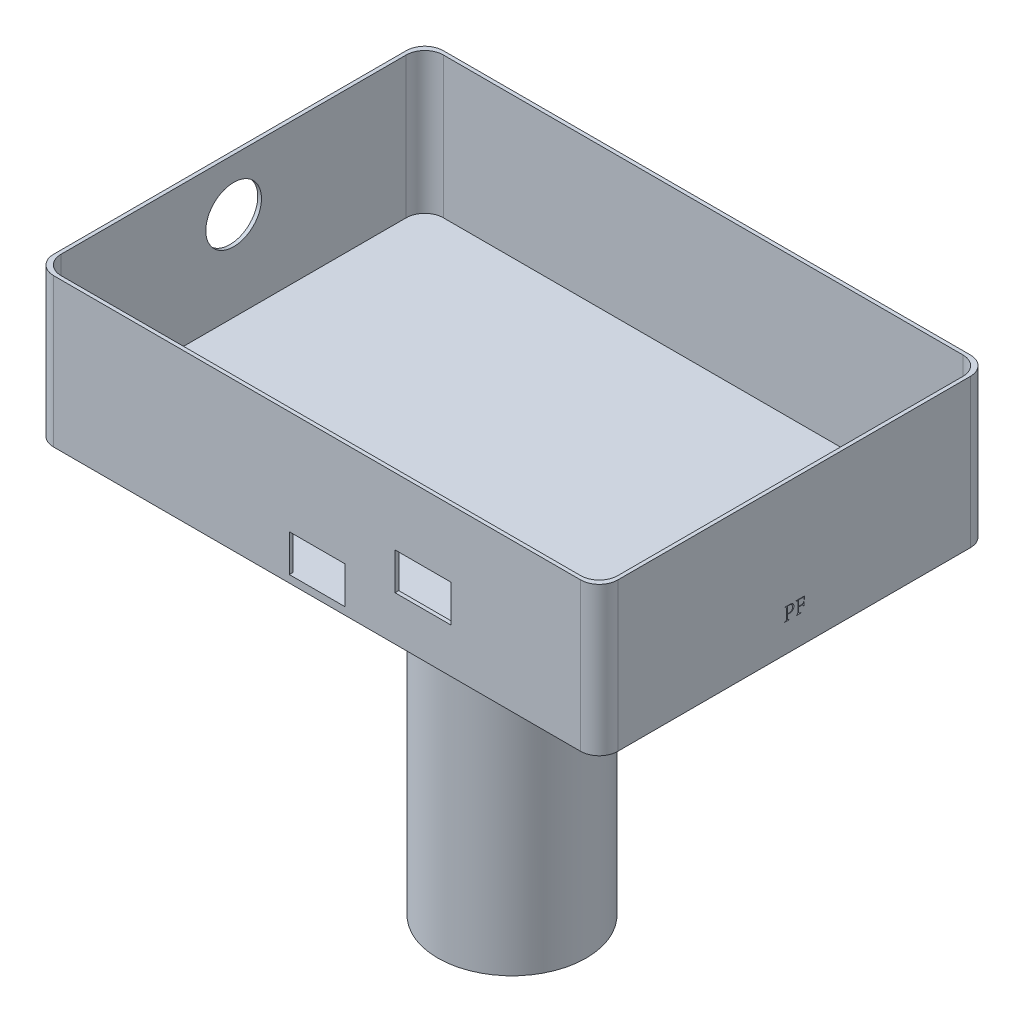
from build123d import *

# Parameters (mm, degrees)
EXTRUDE_4_DEPTH     = 40
SKETCH_4_R          = 20
EXTRUDE_5_DEPTH     = 100
CUT_EXTRUDE_1_DEPTH = 38
SKETCH_9_W          = 15
SKETCH_9_H          = 10
CUT_EXTRUDE_2_DEPTH = 38
SKETCH_13_R         = 7.5
CUT_EXTRUDE_4_DEPTH = 38
SKETCH_14_W         = 15
SKETCH_14_H         = 10
CUT_EXTRUDE_6_DEPTH = 33
CUT_EXTRUDE_7_DEPTH = 0.5


with BuildPart() as part:
    # 草图1 → 凸台-拉伸4 (new body)
    with BuildSketch(Plane(origin=(0, 0, 0), x_dir=(1, 0, 0), z_dir=(0, 1, 0))):
        with BuildLine():
            Line((71, -52.5), (-71, -52.5))
            ThreePointArc((-71, -52.5), (-74.535533906, -51.035533906), (-76, -47.5))
            Line((-76, -47.5), (-76, 47.5))
            ThreePointArc((-76, 47.5), (-74.535533906, 51.035533906), (-71, 52.5))
            Line((-71, 52.5), (71, 52.5))
            ThreePointArc((71, 52.5), (74.535533906, 51.035533906), (76, 47.5))
            Line((76, 47.5), (76, -47.5))
            ThreePointArc((76, -47.5), (74.535533906, -51.035533906), (71, -52.5))
        make_face()
    extrude(amount=EXTRUDE_4_DEPTH)

    # 草图4 → 凸台-拉伸5 (add)
    with BuildSketch(Plane.XZ):
        with Locations(Location((0, 0, 0), (0, 0, 90))):
            Circle(SKETCH_4_R)
    extrude(amount=EXTRUDE_5_DEPTH)

    # 草图5 → 切除-拉伸1 (cut)
    with BuildSketch(Plane(origin=(0, 40, 0), x_dir=(1, 0, 0), z_dir=(0, 1, 0))):
        with BuildLine():
            Line((70, -51.5), (-70, -51.5))
            ThreePointArc((-70, -51.5), (-73.535533906, -50.035533906), (-75, -46.5))
            Line((-75, -46.5), (-75, 46.5))
            ThreePointArc((-75, 46.5), (-73.535533906, 50.035533906), (-70, 51.5))
            Line((-70, 51.5), (70, 51.5))
            ThreePointArc((70, 51.5), (73.535533906, 50.035533906), (75, 46.5))
            Line((75, 46.5), (75, -46.5))
            ThreePointArc((75, -46.5), (73.535533906, -50.035533906), (70, -51.5))
        make_face()
    extrude(amount=-CUT_EXTRUDE_1_DEPTH, mode=Mode.SUBTRACT)

    # 草图9 → 切除-拉伸2 (cut)
    with BuildSketch(Plane.XY.offset(52.5)):
        with Locations((0, 7)):
            Rectangle(SKETCH_9_W, SKETCH_9_H)
    extrude(amount=-CUT_EXTRUDE_2_DEPTH, mode=Mode.SUBTRACT)

    # 草图13 → 切除-拉伸4 (cut)
    with BuildSketch(Plane.ZY.offset(76)):
        with Locations((0, 26)):
            Circle(SKETCH_13_R)
    extrude(amount=-CUT_EXTRUDE_4_DEPTH, mode=Mode.SUBTRACT)

    # 草图14 → 切除-拉伸6 (cut)
    with BuildSketch(Plane.XY.offset(52.5)):
        with Locations((28.5, 17)):
            Rectangle(SKETCH_14_W, SKETCH_14_H)
    extrude(amount=-CUT_EXTRUDE_6_DEPTH, mode=Mode.SUBTRACT)

    # 草图15 → 切除-拉伸7 (cut)
    # profile 1 of 2: a face of its own
    with BuildSketch(Plane(origin=(76, 0, 0), x_dir=(0, 0, -1), z_dir=(1, 0, 0))):
        with BuildLine():
            Line((-2.580433871, 7.615726026), (-1.184449748, 7.615726026))
            Line((-1.184449748, 7.615726026), (-1.184449748, 7.702983664))
            add(Edge.make_bspline(
                [(-1.184449748, 7.702983664), (-1.217887836, 7.704611127), (-1.281310199, 7.707697954), (-1.371570183, 7.716076705), (-1.452188861, 7.725517964), (-1.522984698, 7.740587685), (-1.584238129, 7.756859859), (-1.636092582, 7.776290379), (-1.678677618, 7.798158136), (-1.712060535, 7.825330905), (-1.737693269, 7.857367058), (-1.758960256, 7.894767642), (-1.776807786, 7.938377806), (-1.788989433, 7.989121396), (-1.798954138, 8.045760276), (-1.803947593, 8.10928206), (-1.806924831, 8.179133503), (-1.804608248, 8.227877841), (-1.80340521, 8.253191544)],
                knots=[0, 0, 0, 0, 1.610224412, 3.054129168, 4.360599012, 5.511614898, 6.533143897, 7.406572097, 8.171725483, 8.825313618, 9.460670599, 10.133992217, 10.889431778, 11.719000167, 12.639127231, 13.653731648, 14.781545869, 16, 16, 16, 16], degree=3))
            Line((-1.80340521, 8.253191544), (-1.80340521, 9.168971463))
            Line((-1.80340521, 9.168971463), (-1.349125342, 9.063555665))
            add(Edge.make_bspline(
                [(-1.349125342, 9.063555665), (-1.313407427, 9.060448233), (-1.241972221, 9.054233423), (-1.134088744, 9.057226738), (-1.026491828, 9.069244977), (-0.919397483, 9.09115194), (-0.8131608, 9.123224615), (-0.706868332, 9.163612709), (-0.601038304, 9.213985577), (-0.496619222, 9.27302888), (-0.397094747, 9.341624436), (-0.310282121, 9.424762169), (-0.233624583, 9.51722492), (-0.172009666, 9.622897296), (-0.120233509, 9.738274164), (-0.082947926, 9.865548019), (-0.056679339, 10.003585749), (-0.049725119, 10.099757617), (-0.046133345, 10.149429275)],
                knots=[0, 0, 0, 0, 0.895391462, 1.790767267, 2.691590428, 3.598402855, 4.518333195, 5.4620595, 6.437508577, 7.444288359, 8.458286257, 9.44859864, 10.438796661, 11.449931416, 12.495491309, 13.592056924, 14.756325249, 16, 16, 16, 16], degree=3))
            add(Edge.make_bspline(
                [(-0.046133345, 10.149429275), (-0.050867358, 10.202863163), (-0.059937832, 10.305243687), (-0.087522531, 10.450444572), (-0.128774532, 10.579646587), (-0.182093158, 10.693268606), (-0.24744051, 10.79169477), (-0.326685217, 10.873361857), (-0.418041904, 10.939022364), (-0.520539476, 10.985615104), (-0.625214666, 11.022099111), (-0.727706194, 11.053736118), (-0.826357096, 11.079625145), (-0.921130609, 11.10035463), (-1.012403319, 11.113936181), (-1.099777459, 11.122060151), (-1.183501439, 11.125266693), (-1.237857238, 11.121576074), (-1.264508505, 11.119766521)],
                knots=[0, 0, 0, 0, 1.445463838, 2.769541052, 3.974832343, 5.091891974, 6.142931429, 7.144046555, 8.143238359, 9.156363058, 10.166726981, 11.131189545, 12.046821227, 12.915368631, 13.744935411, 14.532326559, 15.280383024, 16, 16, 16, 16], degree=3))
            Line((-1.264508505, 11.119766521), (-2.546926408, 11.120573673))
            Line((-2.546926408, 11.120573673), (-2.546926408, 11.047858186))
            add(Edge.make_bspline(
                [(-2.546926408, 11.047858186), (-2.519113283, 11.046605321), (-2.466210685, 11.044222281), (-2.390778606, 11.039380374), (-2.323844346, 11.029666864), (-2.265398562, 11.017070124), (-2.215635131, 11.001255054), (-2.174493065, 10.981815226), (-2.14132869, 10.959515086), (-2.116186354, 10.932010665), (-2.098648993, 10.898804169), (-2.083154106, 10.860727055), (-2.071203393, 10.815659302), (-2.062790431, 10.763681545), (-2.056263177, 10.704905612), (-2.053248632, 10.639076125), (-2.05349167, 10.566573064), (-2.055331496, 10.515961179), (-2.05629077, 10.489572473)],
                knots=[0, 0, 0, 0, 1.469172523, 2.794473568, 3.98619609, 5.034299873, 5.946533644, 6.734663907, 7.428501719, 8.042184951, 8.678485103, 9.398881281, 10.208995993, 11.131793981, 12.175360288, 13.327801444, 14.606733132, 16, 16, 16, 16], degree=3))
            Line((-2.05629077, 10.489572473), (-2.055483618, 8.265228604))
            add(Edge.make_bspline(
                [(-2.055483618, 8.265228604), (-2.055086813, 8.239137028), (-2.054329569, 8.18934508), (-2.055237138, 8.117860075), (-2.061440663, 8.05322217), (-2.068677643, 7.994697701), (-2.081000159, 7.942863416), (-2.095806553, 7.897366932), (-2.114855608, 7.858714559), (-2.136513671, 7.824960353), (-2.165954266, 7.797296608), (-2.201708529, 7.772862243), (-2.246216778, 7.753073059), (-2.297997972, 7.736368002), (-2.357488345, 7.722805269), (-2.42467847, 7.712268763), (-2.5000366, 7.706394752), (-2.552898268, 7.704157803), (-2.580644535, 7.702983664)],
                knots=[0, 0, 0, 0, 1.352566959, 2.581175796, 3.702071017, 4.716683575, 5.634193904, 6.459598048, 7.189955645, 7.863557963, 8.524901329, 9.268214695, 10.098795313, 11.038958449, 12.085146358, 13.257772726, 14.560647532, 16, 16, 16, 16], degree=3))
            Line((-2.580644535, 7.702983664), (-2.580433871, 7.615726026))
        make_face()
        with BuildLine():
            add(Edge.make_bspline(
                [(-1.80340521, 10.870368363), (-1.803275178, 10.883485644), (-1.803038031, 10.907408495), (-1.800853886, 10.939442273), (-1.797114279, 10.964223374), (-1.790438189, 10.98650258), (-1.774527452, 11.007344278), (-1.756000381, 11.010127635), (-1.746849334, 11.011502415)],
                knots=[0, 0, 0, 0, 1.400212761, 2.553660238, 3.428222368, 4.06475085, 5.044125359, 6, 6, 6, 6], degree=3))
            add(Edge.make_bspline(
                [(-1.746849334, 11.011502415), (-1.732333412, 11.013896229), (-1.697033855, 11.019717464), (-1.634027929, 11.022492428), (-1.552150696, 11.02418129), (-1.491274448, 11.02330064), (-1.457606424, 11.02281359)],
                knots=[0, 0, 0, 0, 0.60862256, 1.480037451, 2.606317572, 4, 4, 4, 4], degree=3))
            add(Edge.make_bspline(
                [(-1.457606424, 11.02281359), (-1.415028593, 11.02294623), (-1.332708624, 11.023202674), (-1.21324392, 11.012612629), (-1.101724199, 10.997619245), (-0.998676435, 10.972843602), (-0.903560234, 10.942506908), (-0.816245841, 10.904707718), (-0.737813817, 10.858182896), (-0.66659504, 10.805901042), (-0.604804481, 10.74498294), (-0.549814555, 10.677868387), (-0.504883746, 10.602024457), (-0.467676446, 10.519549093), (-0.437091671, 10.430515764), (-0.418012963, 10.33345159), (-0.404436289, 10.229793047), (-0.4025826, 10.158095807), (-0.401627424, 10.121151337)],
                knots=[0, 0, 0, 0, 1.281728033, 2.478092719, 3.609181804, 4.667700609, 5.665553503, 6.613529977, 7.526142766, 8.407058906, 9.267495489, 10.132736248, 11.01331621, 11.913552417, 12.854946971, 13.841293126, 14.887652011, 16, 16, 16, 16], degree=3))
            add(Edge.make_bspline(
                [(-0.401627424, 10.121151337), (-0.403263666, 10.081802189), (-0.406433639, 10.005569119), (-0.419511634, 9.895343473), (-0.442762129, 9.794270143), (-0.471012268, 9.700832781), (-0.509575532, 9.616604898), (-0.554553588, 9.53987683), (-0.608257919, 9.471973879), (-0.670479969, 9.414003602), (-0.737523718, 9.363074736), (-0.809183381, 9.319383045), (-0.884427059, 9.281834134), (-0.964182583, 9.252156893), (-1.047593284, 9.228447812), (-1.135243127, 9.212448638), (-1.226881723, 9.203537277), (-1.289265713, 9.202864998), (-1.321064381, 9.202522321)],
                knots=[0, 0, 0, 0, 1.278718646, 2.477325474, 3.597568387, 4.643053014, 5.641120743, 6.597994187, 7.525359563, 8.440897669, 9.352165556, 10.255086548, 11.162443487, 12.078524405, 13.01430469, 13.974847691, 14.967729619, 16, 16, 16, 16], degree=3))
            add(Edge.make_bspline(
                [(-1.321064381, 9.202522321), (-1.352578093, 9.203434737), (-1.412419569, 9.205167326), (-1.497174897, 9.210150382), (-1.571897215, 9.219883304), (-1.636388903, 9.232475544), (-1.690991351, 9.247766011), (-1.736659199, 9.261024443), (-1.77350676, 9.273639987), (-1.794304217, 9.283180983), (-1.80340521, 9.287356135)],
                knots=[0, 0, 0, 0, 1.534207126, 2.913310228, 4.129203918, 5.198384672, 6.107569974, 6.887083024, 7.512986147, 8, 8, 8, 8], degree=3))
            Line((-1.80340521, 9.287356135), (-1.80340521, 10.870368363))
        make_face(mode=Mode.SUBTRACT)
    # profile 2 of 2: a face of its own
    with BuildSketch(Plane(origin=(76, 0, 0), x_dir=(0, 0, -1), z_dir=(1, 0, 0))):
        with BuildLine():
            Line((0.481520828, 7.615726026), (1.858590923, 7.615726026))
            Line((1.858590923, 7.615726026), (1.858590923, 7.702983664))
            add(Edge.make_bspline(
                [(1.858590923, 7.702983664), (1.826127243, 7.704399003), (1.764235555, 7.707097335), (1.676171643, 7.714060831), (1.597655207, 7.724364586), (1.528448838, 7.737809985), (1.468583714, 7.75486599), (1.417150913, 7.77347354), (1.375453186, 7.796364383), (1.341145047, 7.821675688), (1.315676216, 7.853569353), (1.293369387, 7.889399026), (1.275988646, 7.931811364), (1.262349955, 7.979783361), (1.252717181, 8.033647793), (1.247620787, 8.093382205), (1.244863565, 8.159192631), (1.246515616, 8.204984741), (1.247380335, 8.228953311)],
                knots=[0, 0, 0, 0, 1.612812098, 3.074810424, 4.383035268, 5.541760787, 6.570003785, 7.471184564, 8.248906435, 8.925378342, 9.5706208, 10.260691492, 11.015443248, 11.836202244, 12.732910634, 13.726509569, 14.810006438, 16, 16, 16, 16], degree=3))
            Line((1.247380335, 8.228953311), (1.247380335, 9.322096813))
            Line((1.247380335, 9.322096813), (1.886371788, 9.322096813))
            add(Edge.make_bspline(
                [(1.886371788, 9.322096813), (1.916023097, 9.322224585), (1.972884168, 9.322469607), (2.054394924, 9.320805354), (2.128168324, 9.313701547), (2.194005078, 9.305973761), (2.251483236, 9.29264307), (2.300935893, 9.276944342), (2.342713557, 9.257734164), (2.37774091, 9.234320302), (2.406659175, 9.204727756), (2.432446454, 9.16935428), (2.45698685, 9.127879601), (2.478413044, 9.078842822), (2.498415218, 9.023175994), (2.516927992, 8.960579597), (2.533989114, 8.891349285), (2.542787092, 8.842507294), (2.547357544, 8.817134423)],
                knots=[0, 0, 0, 0, 1.476390129, 2.831211388, 4.056059684, 5.165377168, 6.128153901, 6.988890835, 7.74464011, 8.410338634, 9.074008615, 9.792690908, 10.586041567, 11.468233181, 12.452249512, 13.529751679, 14.716733466, 16, 16, 16, 16], degree=3))
            Line((2.547357544, 8.817134423), (2.642494185, 8.817925795))
            Line((2.642494185, 8.817925795), (2.642494185, 9.886150942))
            Line((2.642494185, 9.886150942), (2.547556373, 9.886150942))
            add(Edge.make_bspline(
                [(2.547556373, 9.886150942), (2.542933924, 9.864227706), (2.534089362, 9.822279939), (2.516752497, 9.763045443), (2.498577215, 9.709732742), (2.478215101, 9.662522671), (2.456640757, 9.620799945), (2.432486716, 9.585292873), (2.406625303, 9.555384723), (2.376963978, 9.531757837), (2.342243746, 9.512664205), (2.300716286, 9.496596657), (2.251231757, 9.484295322), (2.193776426, 9.473676414), (2.128210666, 9.465867693), (2.054317131, 9.461151344), (1.972642773, 9.459812544), (1.915546386, 9.460633605), (1.885653794, 9.461063469)],
                knots=[0, 0, 0, 0, 1.190162907, 2.27724938, 3.27749917, 4.181373813, 5.007218353, 5.769348776, 6.458667662, 7.100122601, 7.772901438, 8.556889018, 9.459403086, 10.478316619, 11.660529519, 12.965676839, 14.411391847, 16, 16, 16, 16], degree=3))
            Line((1.885653794, 9.461063469), (1.247380335, 9.461063469))
            Line((1.247380335, 9.461063469), (1.247380335, 10.82022473))
            add(Edge.make_bspline(
                [(1.247380335, 10.82022473), (1.246989393, 10.836065718), (1.246283917, 10.864651642), (1.250459095, 10.902725528), (1.256339972, 10.93223892), (1.269555706, 10.953777085), (1.291094302, 10.966996047), (1.320345024, 10.972806124), (1.358204927, 10.977098582), (1.38659408, 10.976364455), (1.402505024, 10.975953007)],
                knots=[0, 0, 0, 0, 1.388497183, 2.505618589, 3.35976118, 4.00876083, 4.657760479, 5.51190307, 6.60552478, 8, 8, 8, 8], degree=3))
            Line((1.402505024, 10.975953007), (1.869703269, 10.97675937))
            add(Edge.make_bspline(
                [(1.869703269, 10.97675937), (1.906805024, 10.976852428), (1.978435023, 10.97703209), (2.081410267, 10.971468457), (2.175570019, 10.961092785), (2.260860881, 10.946343292), (2.337242579, 10.925027748), (2.405490742, 10.900007573), (2.464319194, 10.868157763), (2.515438936, 10.830878731), (2.559599617, 10.786079009), (2.599878646, 10.733646409), (2.634724024, 10.671707096), (2.667211651, 10.60177484), (2.69612125, 10.523423687), (2.720956394, 10.436106035), (2.742849161, 10.340402072), (2.753517513, 10.273119685), (2.759038109, 10.238302795)],
                knots=[0, 0, 0, 0, 1.342337298, 2.591565296, 3.729065641, 4.768911272, 5.719339229, 6.595308682, 7.393271532, 8.131968119, 8.876172187, 9.661660477, 10.517449658, 11.441739127, 12.450008598, 13.535606943, 14.724740488, 16, 16, 16, 16], degree=3))
            Line((2.759038109, 10.238302795), (2.860292694, 10.249712596))
            add(Edge.make_bspline(
                [(2.860292694, 10.249712596), (2.853661303, 10.318056227), (2.840147105, 10.457334607), (2.826193495, 10.670165179), (2.815392107, 10.890223929), (2.811775477, 11.039230472), (2.809938397, 11.114918874)],
                knots=[0, 0, 0, 0, 0.950422415, 1.936878263, 2.952029999, 4, 4, 4, 4], degree=3))
            Line((2.809938397, 11.114918874), (0.481520828, 11.115726026))
            Line((0.481520828, 11.115726026), (0.481520828, 11.034664445))
            add(Edge.make_bspline(
                [(0.481520828, 11.034664445), (0.508448985, 11.033392648), (0.559982699, 11.030958748), (0.633241102, 11.023489849), (0.699334136, 11.014605961), (0.757194729, 11.000482558), (0.808105381, 10.985229257), (0.850351381, 10.964536377), (0.886025271, 10.942203236), (0.9144048, 10.915492057), (0.93722483, 10.884301966), (0.954354723, 10.847178411), (0.970011934, 10.804892853), (0.981914541, 10.756403102), (0.989677856, 10.701997492), (0.994093787, 10.642079948), (0.997058206, 10.576301891), (0.995375526, 10.530508485), (0.994494775, 10.506539236)],
                knots=[0, 0, 0, 0, 1.464438099, 2.802565824, 4.000800486, 5.08336855, 6.036669827, 6.880974873, 7.631850343, 8.315086332, 8.985349306, 9.718330476, 10.528466094, 11.433486157, 12.424777963, 13.511196311, 14.69730687, 16, 16, 16, 16], degree=3))
            Line((0.994494775, 10.506539236), (0.995301927, 8.229639746))
            add(Edge.make_bspline(
                [(0.995301927, 8.229639746), (0.99584107, 8.205440385), (0.996866556, 8.159411542), (0.994140811, 8.093413359), (0.989666853, 8.033494911), (0.98191716, 7.97908937), (0.970011176, 7.930600063), (0.954355402, 7.888312937), (0.937223036, 7.851194463), (0.914410831, 7.819987224), (0.886001264, 7.793342185), (0.850553434, 7.770787346), (0.807850942, 7.751381722), (0.757360226, 7.735434001), (0.699104038, 7.723136567), (0.633406202, 7.712159941), (0.559900482, 7.706447625), (0.508388425, 7.70417306), (0.481452184, 7.702983664)],
                knots=[0, 0, 0, 0, 1.314527581, 2.500321573, 3.586449961, 4.577477195, 5.482255712, 6.292175109, 7.02496065, 7.695044734, 8.37809837, 9.128773434, 9.966618049, 10.919664894, 11.998676238, 13.198822267, 14.535232312, 16, 16, 16, 16], degree=3))
            Line((0.481452184, 7.702983664), (0.481520828, 7.615726026))
        make_face()
    extrude(amount=-CUT_EXTRUDE_7_DEPTH, mode=Mode.SUBTRACT)


solid = part.part
